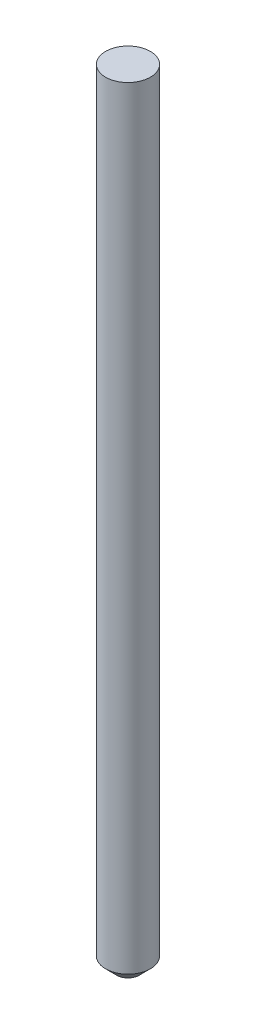
from build123d import *

# Parameters (mm, degrees)
SKETCH1_R           = 4
BOSS_EXTRUDE1_DEPTH = 140
CHAMFER1_SIZE       = 2


with BuildPart() as part:
    # Sketch1 → Boss-Extrude1 (new body)
    with BuildSketch(Plane(origin=(0, 0, 0), x_dir=(1, 0, 0), z_dir=(0, 1, 0))):
        with Locations(Location((0, 0, 0), (0, 0, 270))):
            Circle(SKETCH1_R)
    extrude(amount=BOSS_EXTRUDE1_DEPTH)

    # Chamfer1
    chamfer1_edges = [part.edges().sort_by_distance(p)[0] for p in [
        (0, 0, -4),
    ]]
    chamfer(chamfer1_edges, length=CHAMFER1_SIZE)


solid = part.part
